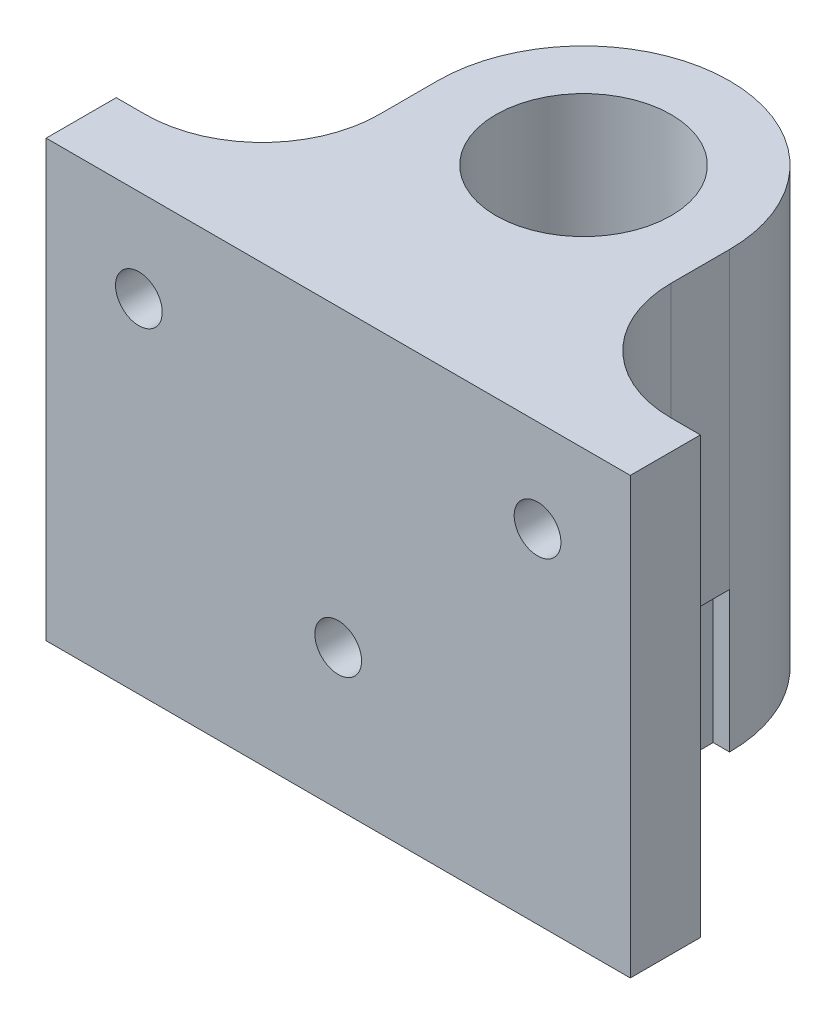
from build123d import *

# Parameters (mm, degrees)
PROFILE_SKETCH1_R                         = 7.5
PROFILE_BOSS_EXTRUDE2_DEPTH               = 37.25987
FASTENINGHOLESKETCH3_R                    = 2
FASTENINGHOLECUT_EXTRUDE8_DEPTH           = 56.995963358
LM8UUFASTENINGHOLESKETCH5_R               = 2
LM8UUFASTENINGHOLECUT_EXTRUDE9_DEPTH      = 56.995963425
MICROSWITCHCUT_EXTRUDE1_DEPTH             = 12.05
MICROSWITCHMOUNTINGHOLESKETCH2_R          = 1.5
MICROSWITCHMOUNTINGHOLECUT_EXTRUDE2_DEPTH = 3.1


with BuildPart() as part:
    # Profile-Sketch1 → Profile-Boss-Extrude2 (new body)
    with BuildSketch(Plane(origin=(0, 0, 0), x_dir=(1, 0, 0), z_dir=(0, 1, 0))):
        with BuildLine():
            Line((-25, -21), (25, -21))
            Line((25, -21), (25, -15))
            Line((25, -15), (22.5, -15))
            ThreePointArc((22.5, -15), (15.428932188, -12.071067812), (12.5, -5))
            Line((12.5, -5), (12.5, 0))
            ThreePointArc((12.5, 0), (0, 12.5), (-12.5, 0))
            Line((-12.5, 0), (-12.5, -5))
            ThreePointArc((-12.5, -5), (-15.428932188, -12.071067812), (-22.5, -15))
            Line((-22.5, -15), (-25, -15))
            Line((-25, -15), (-25, -21))
        make_face()
        with Locations(Location((0, 0, 0), (0, 0, 270))):
            Circle(PROFILE_SKETCH1_R, mode=Mode.SUBTRACT)
    extrude(amount=PROFILE_BOSS_EXTRUDE2_DEPTH)

    # FasteningHoleSketch3 → FasteningHoleCut-Extrude8 (cut, through all)
    with BuildSketch(Plane.XY.offset(21)):
        with Locations((-17.0625, 29.32237)):
            Circle(FASTENINGHOLESKETCH3_R)
        with Locations((17.0625, 29.32237)):
            Circle(FASTENINGHOLESKETCH3_R)
    extrude(amount=-FASTENINGHOLECUT_EXTRUDE8_DEPTH, mode=Mode.SUBTRACT)

    # LM8UUFasteningHoleSketch5 → LM8UUFasteningHoleCut-Extrude9 (cut, through all)
    with BuildSketch(Plane.XY.offset(21)):
        with Locations((0, 12)):
            Circle(LM8UUFASTENINGHOLESKETCH5_R)
    extrude(amount=-LM8UUFASTENINGHOLECUT_EXTRUDE9_DEPTH, mode=Mode.SUBTRACT)

    # Sketch1 → MicroSwitchCut-Extrude1 (cut)
    with BuildSketch(Plane.XZ):
        Polygon((13.9, 12.85), (16.363847734, 12.85), (13.9, 10.102940329), (13.9, 0), (11.1, 0), (11.1, 12.85), align=None)
    extrude(amount=-MICROSWITCHCUT_EXTRUDE1_DEPTH, mode=Mode.SUBTRACT)

    # MicroSwitchMountingHoleSketch2 → MicroSwitchMountingHoleCut-Extrude2 (cut)
    with BuildSketch(Plane(origin=(11.1, 0, 0), x_dir=(0, 0, -1), z_dir=(1, 0, 0))):
        with Locations((-9.6, 5.05)):
            Circle(MICROSWITCHMOUNTINGHOLESKETCH2_R)
        with Locations((-3.25, 5.05)):
            Circle(MICROSWITCHMOUNTINGHOLESKETCH2_R)
    extrude(amount=-MICROSWITCHMOUNTINGHOLECUT_EXTRUDE2_DEPTH, mode=Mode.SUBTRACT)


solid = part.part
